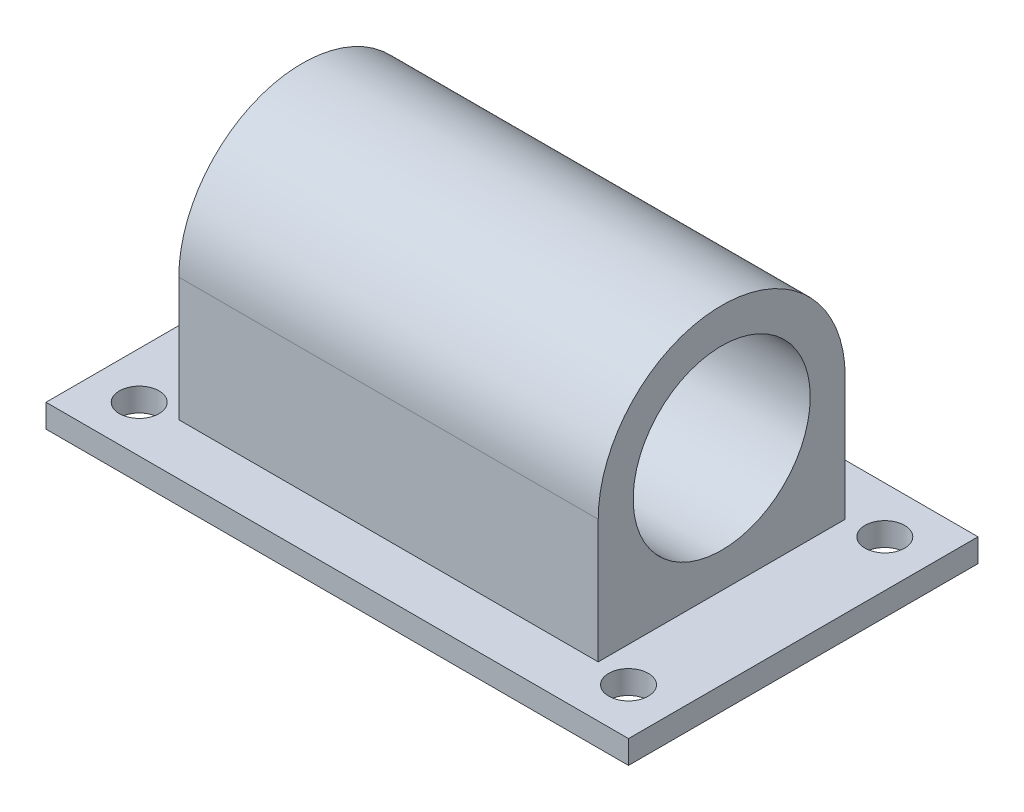
from build123d import *

# Parameters (mm, degrees)
SCHIZZO1_W                   = 50
SCHIZZO1_H                   = 30
ESTRUSIONE_ESTRUSIONE1_DEPTH = 2
SCHIZZO2_R                   = 7.6
ESTRUSIONE_ESTRUSIONE2_DEPTH = 18
SCHIZZO3_R                   = 1.7
TAGLIO_ESTRUSIONE1_DEPTH     = 37.047746115


with BuildPart() as part:
    # Schizzo1 → Estrusione-Estrusione1 (new body)
    with BuildSketch(Plane(origin=(0, 0, 0), x_dir=(1, 0, 0), z_dir=(0, 1, 0))):
        Rectangle(SCHIZZO1_W, SCHIZZO1_H)
    extrude(amount=ESTRUSIONE_ESTRUSIONE1_DEPTH)

    # Schizzo3 → Taglio-Estrusione1 (cut, through all)
    with BuildSketch(Plane(origin=(0, 2, 0), x_dir=(1, 0, 0), z_dir=(0, 1, 0))):
        with Locations(Location((-21, 11, 0), (0, 0, 270))):
            Circle(SCHIZZO3_R)
        with Locations(Location((21, 11, 0), (0, 0, 90))):
            Circle(SCHIZZO3_R)
        with Locations(Location((-21, -11, 0), (0, 0, 90))):
            Circle(SCHIZZO3_R)
        with Locations(Location((21, -11, 0), (0, 0, 270))):
            Circle(SCHIZZO3_R)
    extrude(amount=-TAGLIO_ESTRUSIONE1_DEPTH, mode=Mode.SUBTRACT)


with BuildPart() as body_2:
    # Schizzo2 → Estrusione-Estrusione2 (new, symmetric)
    with BuildSketch(Plane(origin=(0, 0, 0), x_dir=(0, 0, -1), z_dir=(1, 0, 0))):
        with BuildLine():
            Line((-10.6, 12.6), (-10.6, 2))
            Line((-10.6, 2), (10.6, 2))
            Line((10.6, 2), (10.6, 12.6))
            ThreePointArc((10.6, 12.6), (0, 23.2), (-10.6, 12.6))
        make_face()
        with Locations((0, 12.6)):
            Circle(SCHIZZO2_R, mode=Mode.SUBTRACT)
    extrude(amount=ESTRUSIONE_ESTRUSIONE2_DEPTH, both=True)


solid = Compound([part.part, body_2.part])
